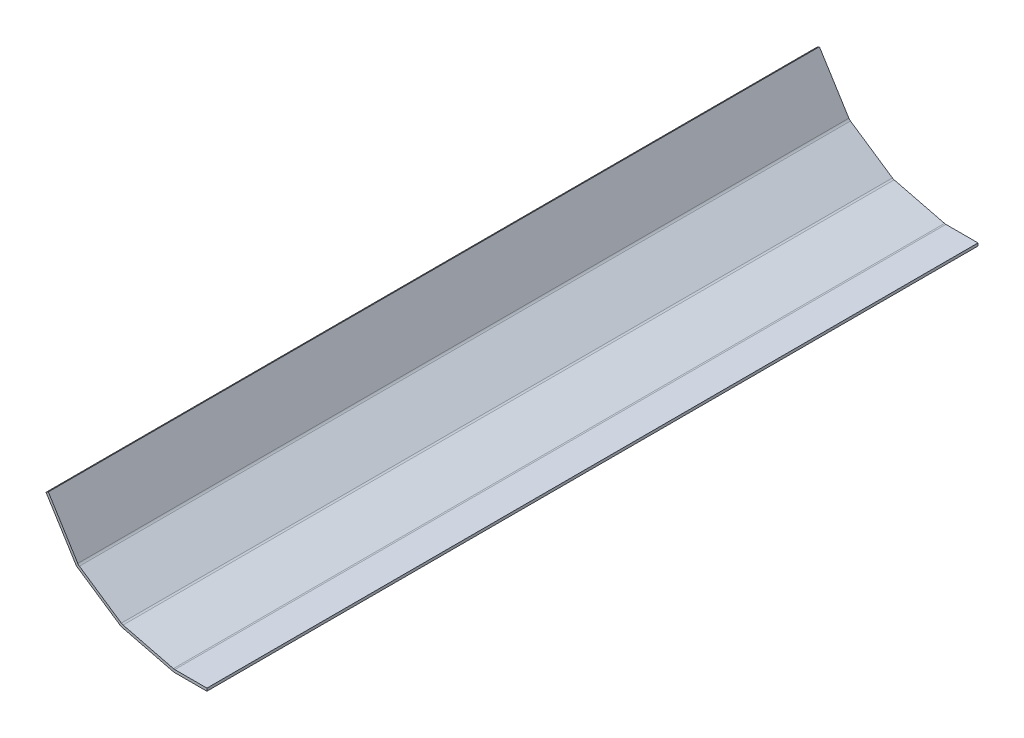
from build123d import *

# Parameters (mm, degrees)
CONTINUOUS_OUTER_IMPACT_SKIN_DEPTH = 282


with BuildPart() as part:
    # Continuous outer impact skin profile → Continuous outer impact skin (new body)
    with BuildSketch(Plane.XY):
        with BuildLine():
            Line((152, 3), (140.245569122, 3))
            ThreePointArc((140.245569122, 3), (140.001830435, 3.014907697), (139.761725331, 3.059408547))
            Line((139.761725331, 3.059408547), (121.342178632, 7.651917339))
            ThreePointArc((121.342178632, 7.651917339), (121.012549136, 7.765417876), (120.707636616, 7.934433647))
            Line((120.707636616, 7.934433647), (105.352434752, 18.291648082))
            ThreePointArc((105.352434752, 18.291648082), (105.032140958, 18.560406486), (104.774724366, 18.889884698))
            Line((104.774724366, 18.889884698), (94, 36.133048143))
            Line((94, 36.133048143), (93.151951903, 35.603128878))
            Line((93.151951903, 35.603128878), (103.926676269, 18.359965433))
            ThreePointArc((103.926676269, 18.359965433), (104.312801157, 17.865748115), (104.793241848, 17.462610509))
            Line((104.793241848, 17.462610509), (120.148443712, 7.105396074))
            ThreePointArc((120.148443712, 7.105396074), (120.605812493, 6.851872418), (121.100256736, 6.681621612))
            Line((121.100256736, 6.681621612), (139.519803435, 2.08911282))
            ThreePointArc((139.519803435, 2.08911282), (139.879961091, 2.022361545), (140.245569122, 1.999999999))
            Line((140.245569122, 1.999999999), (152, 1.999999999))
            Line((152, 1.999999999), (152, 3))
        make_face()
    extrude(amount=CONTINUOUS_OUTER_IMPACT_SKIN_DEPTH)


solid = part.part
